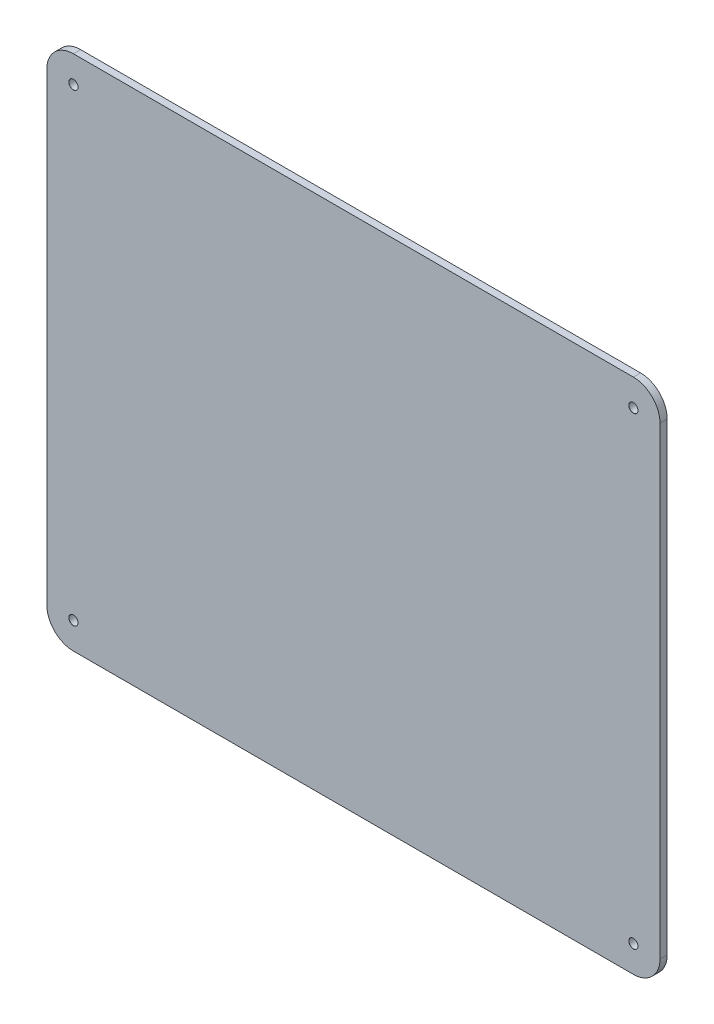
from build123d import *

# Parameters (mm, degrees)
BOSS_EXTRUDE1_DEPTH            = 2.7
M3_CLEARANCE_HOLE1_D           = 3.4
M3_CLEARANCE_HOLE1_CSINK_D     = 3.45
M3_CLEARANCE_HOLE1_CSINK_ANGLE = 90


with BuildPart() as part:
    # Sketch1 → Boss-Extrude1 (new body)
    with BuildSketch(Plane.XY):
        with BuildLine():
            Line((0, -250), (-210, -250))
            ThreePointArc((-210, -250), (-217.071067812, -247.071067812), (-220, -240))
            Line((-220, -240), (-220, -65.98836919))
            ThreePointArc((-220, -65.98836919), (-217.071067812, -58.917301378), (-210, -55.98836919))
            Line((-210, -55.98836919), (0, -55.98836919))
            ThreePointArc((0, -55.98836919), (7.071067812, -58.917301378), (10, -65.98836919))
            Line((10, -65.98836919), (10, -240))
            ThreePointArc((10, -240), (7.071067812, -247.071067812), (0, -250))
        make_face()
    extrude(amount=BOSS_EXTRUDE1_DEPTH)

    # M3 Clearance Hole1 (through all)
    with Locations(Plane(origin=(0, -240, 2.7), x_dir=(1, 0, 0), z_dir=(0, 0, 1))):
        with Locations((0, 0), (-210, 0), (-210, 174.01163081), (0, 174.01163081)):
            CounterSinkHole(M3_CLEARANCE_HOLE1_D / 2, M3_CLEARANCE_HOLE1_CSINK_D / 2, counter_sink_angle=M3_CLEARANCE_HOLE1_CSINK_ANGLE)


solid = part.part
